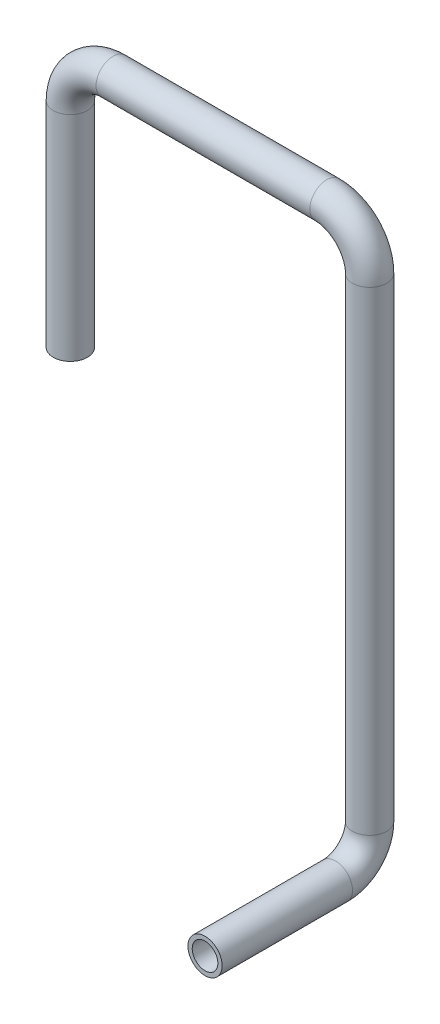
from build123d import *

# Parameters (mm, degrees)
TUBE_PROFILE_R   = 4
TUBE_PROFILE_R_2 = 3


with BuildPart() as part:
    # Tube: sweep along a curve in space
    with BuildLine() as tube_path:
        Line((180, 21, -79.5), (180, 21, -110))
        ThreePointArc((180, 29, -118), (180, 23.343145751, -115.656854249), (180, 21, -110))
        Line((180, 29, -118), (180, 140, -118))
        ThreePointArc((170, 150, -118), (177.071067812, 147.071067812, -118), (180, 140, -118))
        Line((170, 150, -118), (120, 150, -118))
        ThreePointArc((110, 140, -118), (112.928932188, 147.071067812, -118), (120, 150, -118))
        Line((110, 140, -118), (110, 90, -118))
    # Tube profile (on start of the path) → Tube (sweep)
    with BuildSketch(Plane(origin=(180, 21, -79.5), x_dir=(-1, 0, 0), z_dir=(0, 0, -1))):
        Circle(TUBE_PROFILE_R)
        Circle(TUBE_PROFILE_R_2, mode=Mode.SUBTRACT)
    sweep(path=tube_path.line)


solid = part.part
